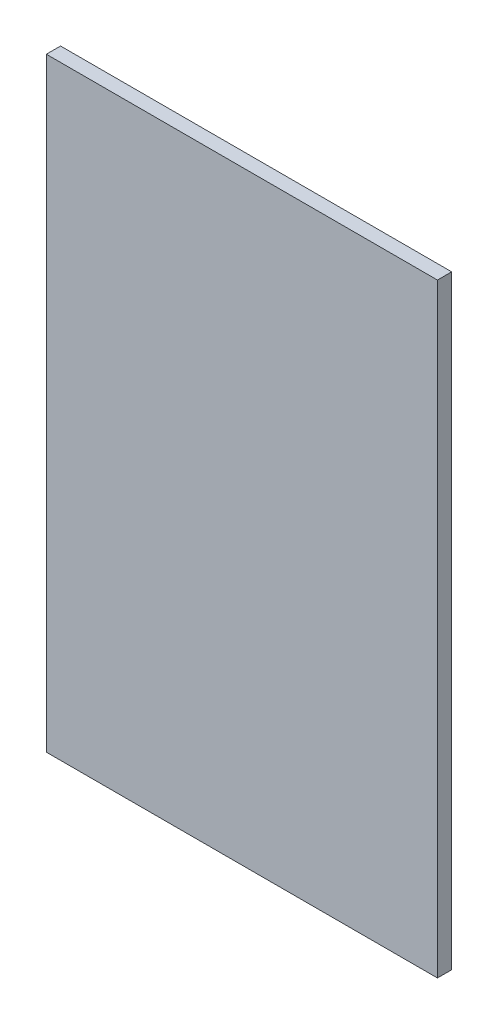
from build123d import *

# Parameters (mm, degrees)
SKETCH_1_W      = 110
SKETCH_1_H      = 4
EXTRUDE_1_DEPTH = 170


with BuildPart() as part:
    # 草图1 → 凸台-拉伸1 (new body)
    with BuildSketch(Plane(origin=(0, 0, 0), x_dir=(1, 0, 0), z_dir=(0, 1, 0))):
        with Locations((45.294117647, 5.87254902)):
            Rectangle(SKETCH_1_W, SKETCH_1_H)
    extrude(amount=EXTRUDE_1_DEPTH)


solid = part.part
